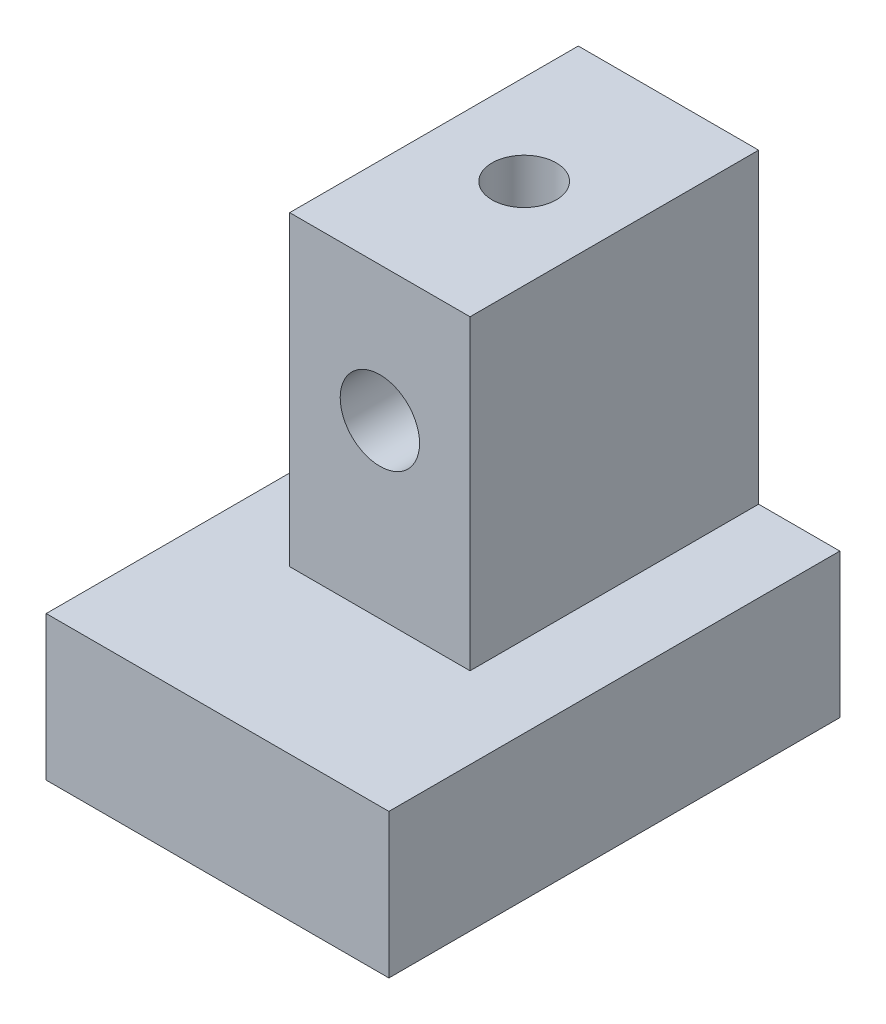
from build123d import *

# Parameters (mm, degrees)
SKETCH1_W                  = 12.065
SKETCH1_H                  = 15.875
BASE_DEPTH                 = 15.875
SKETCH3_R                  = 1.397
SHAFTHOLE_DEPTH            = 19.745948562
SKETCH7_W                  = 18.144441676
SKETCH7_H                  = 22.667604572
SKETCH7_W_2                = 6.35
SKETCH7_H_2                = 10.16
CUT_EXTRUDE1_DEPTH         = 10.795
F_4_40_TAPPED_HOLE1_REACH  = 27.692
F_4_40_TAPPED_HOLE1_BORE_R = 1.1303


with BuildPart() as part:
    # Sketch1 → Base (new body)
    with BuildSketch(Plane.XY):
        Rectangle(SKETCH1_W, SKETCH1_H)
    extrude(amount=BASE_DEPTH)

    # Sketch3 → ShaftHole (cut, through all)
    with BuildSketch(Plane(origin=(0, 0, 0), x_dir=(-1, 0, 0), z_dir=(0, 0, -1))):
        with Locations((0, 3.1877)):
            Circle(SKETCH3_R)
    extrude(amount=-SHAFTHOLE_DEPTH, mode=Mode.SUBTRACT)

    # Sketch7 → Cut-Extrude1 (cut)
    with BuildSketch(Plane(origin=(0, 7.9375, 0), x_dir=(1, 0, 0), z_dir=(0, 1, 0))):
        with Locations((0.669483701, -7.615912702)):
            Rectangle(SKETCH7_W, SKETCH7_H)
        with Locations((0, -5.08)):
            Rectangle(SKETCH7_W_2, SKETCH7_H_2, mode=Mode.SUBTRACT)
    extrude(amount=-CUT_EXTRUDE1_DEPTH, mode=Mode.SUBTRACT)

    # #4-40 Tapped Hole1 bore → #4-40 Tapped Hole1 (cut, up to next)
    with BuildSketch(Plane(origin=(5.103236707, 7.9375, -0.979692924), x_dir=(0, 0, 1), z_dir=(0, 1, 0)), mode=Mode.PRIVATE) as f_4_40_tapped_hole1_sk1:
        with Locations((6.059692924, -5.103236707)):
            Circle(F_4_40_TAPPED_HOLE1_BORE_R)
    f_4_40_tapped_hole1_tool1 = extrude(f_4_40_tapped_hole1_sk1.sketch, amount=-F_4_40_TAPPED_HOLE1_REACH, mode=Mode.PRIVATE) & part.part
    add(f_4_40_tapped_hole1_tool1.solids().sort_by_distance((0, 7.9375, 5.08))[0], mode=Mode.SUBTRACT)


solid = part.part
